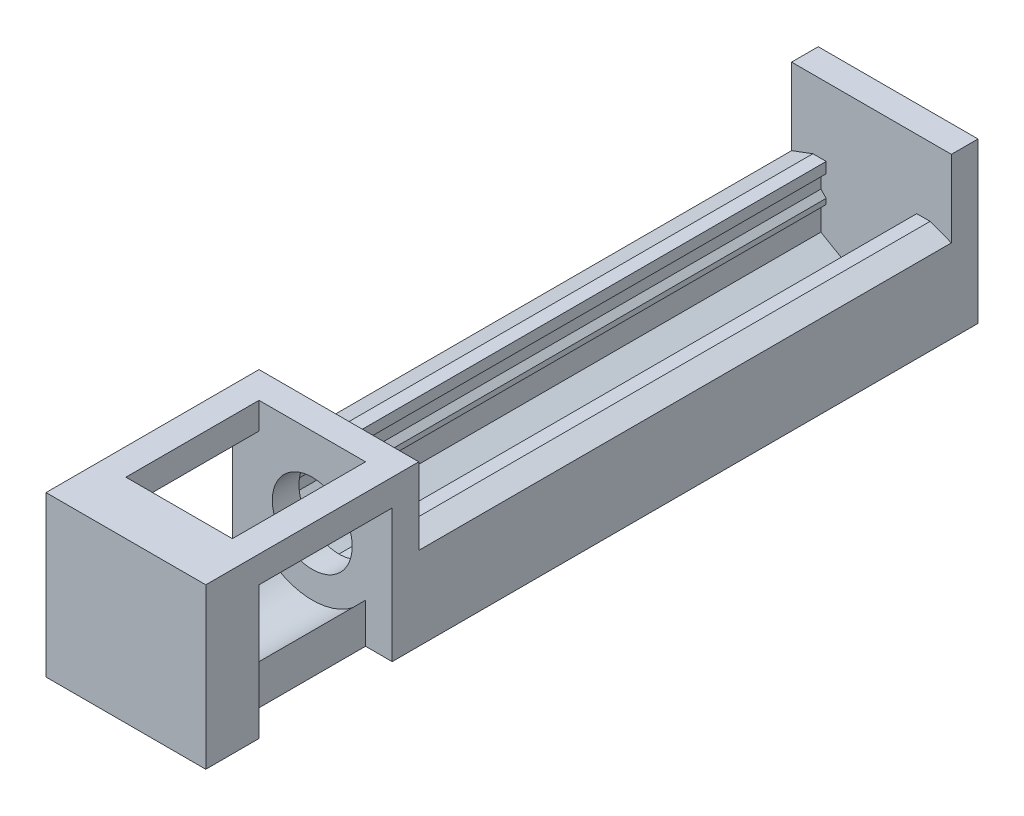
from build123d import *

# Parameters (mm, degrees)
SKETCH1_W           = 60
SKETCH1_H           = 60
BOSS_EXTRUDE1_DEPTH = 80
CUT_EXTRUDE3_DEPTH  = 60
SKETCH6_W           = 60
SKETCH6_H           = 60
BOSS_EXTRUDE3_DEPTH = 10
SKETCH7_R           = 15
CUT_EXTRUDE4_DEPTH  = 10
BOSS_EXTRUDE4_DEPTH = 200
SKETCH10_W          = 60
SKETCH10_H          = 10
BOSS_EXTRUDE5_DEPTH = 60


with BuildPart() as part:
    # Sketch1 → Boss-Extrude1 (new body)
    with BuildSketch(Plane.XY):
        Rectangle(SKETCH1_W, SKETCH1_H)
    extrude(amount=BOSS_EXTRUDE1_DEPTH)

    # Sketch5 → Cut-Extrude3 (cut)
    with BuildSketch(Plane(origin=(0, 0, 0), x_dir=(-1, 0, 0), z_dir=(0, 0, -1))):
        with BuildLine():
            Line((20, 30), (-20, 30))
            Line((-20, 30), (-20, 20))
            Line((-20, 20), (-30, 20))
            Line((-30, 20), (-30, -30))
            Line((-30, -30), (-20, -30))
            Line((-20, -30), (-20, -15))
            ThreePointArc((-20, -15), (0, -25), (20, -15))
            Line((20, -15), (20, -30))
            Line((20, -30), (30, -30))
            Line((30, -30), (30, 20))
            Line((30, 20), (20, 20))
            Line((20, 20), (20, 30))
        make_face()
    extrude(amount=-CUT_EXTRUDE3_DEPTH, mode=Mode.SUBTRACT)

    # Sketch6 → Boss-Extrude3 (add)
    with BuildSketch(Plane(origin=(0, 0, 0), x_dir=(-1, 0, 0), z_dir=(0, 0, -1))):
        Rectangle(SKETCH6_W, SKETCH6_H)
    extrude(amount=-BOSS_EXTRUDE3_DEPTH)

    # Sketch7 → Cut-Extrude4 (cut)
    with BuildSketch(Plane(origin=(0, 0, 0), x_dir=(-1, 0, 0), z_dir=(0, 0, -1))):
        Circle(SKETCH7_R)
    extrude(amount=-CUT_EXTRUDE4_DEPTH, mode=Mode.SUBTRACT)

    # Sketch8 → Boss-Extrude4 (add)
    with BuildSketch(Plane(origin=(0, 0, 0), x_dir=(-1, 0, 0), z_dir=(0, 0, -1))):
        Polygon((-30, -25), (-10, -25), (-19, -19.803847577), (-19, -11.803847577), (-17, -9.803847577), (-17, -7.803847577), (-19, -5.803847577), (-19, 0.196152423), (-17, 0.196152423), (-17, 4.196152423), (-22, 4.196152423), (-30, 1.196152423), align=None)
        Polygon((19, -19.803847577), (10, -25), (30, -25), (30, 1.196152423), (22, 4.196152423), (17, 4.196152423), (17, 0.196152423), (19, 0.196152423), (19, -5.803847577), (17, -7.803847577), (17, -9.803847577), (19, -11.803847577), align=None)
        Polygon((10, -25), (0, -25), (0, -30), (30, -30), (30, -25), align=None)
        Polygon((0, -30), (0, -25), (-10, -25), (-30, -25), (-30, -30), align=None)
    extrude(amount=BOSS_EXTRUDE4_DEPTH)

    # Sketch10 → Boss-Extrude5 (add)
    with BuildSketch(Plane.XZ.offset(30)):
        with Locations((0, -205)):
            Rectangle(SKETCH10_W, SKETCH10_H)
    extrude(amount=-BOSS_EXTRUDE5_DEPTH)


solid = part.part
